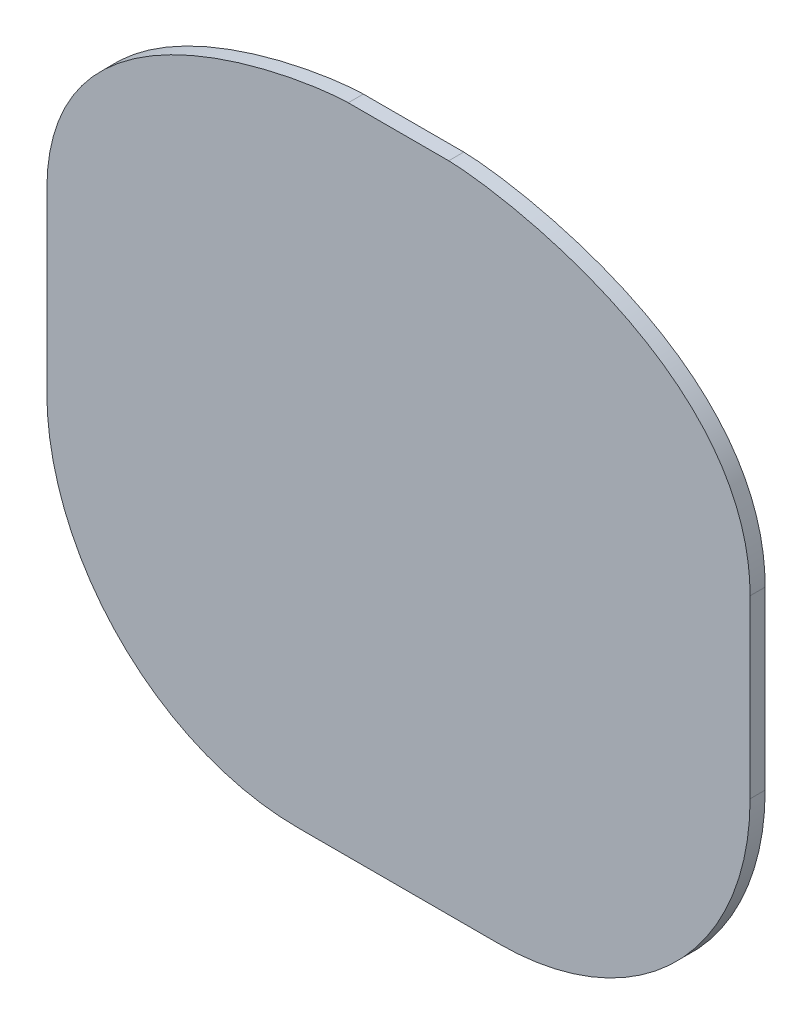
from build123d import *

# Parameters (mm, degrees)
BOSS_EXTRUDE1_DEPTH = 3


with BuildPart() as part:
    # Sketch1 → Boss-Extrude1 (new body)
    with BuildSketch(Plane.XY):
        with BuildLine():
            add(Edge.make_bspline(
                [(-70, -11.5), (-70, 26.5), (-18, 33.5), (-10, 33.5)],
                knots=[0, 0, 0, 0, 1, 1, 1, 1], degree=3))
            Line((-70, -11.5), (-70, -46.5))
            ThreePointArc((-70, -46.5), (-55.355339059, -81.855339059), (-20, -96.5))
            Line((-20, -96.5), (20, -96.5))
            ThreePointArc((20, -96.5), (55.355339059, -81.855339059), (70, -46.5))
            Line((70, -46.5), (70, -11.5))
            add(Edge.make_bspline(
                [(10, 33.5), (18, 33.5), (70, 26.5), (70, -11.5)],
                knots=[0, 0, 0, 0, 1, 1, 1, 1], degree=3))
            Line((10, 33.5), (-10, 33.5))
        make_face()
    extrude(amount=BOSS_EXTRUDE1_DEPTH)


solid = part.part
